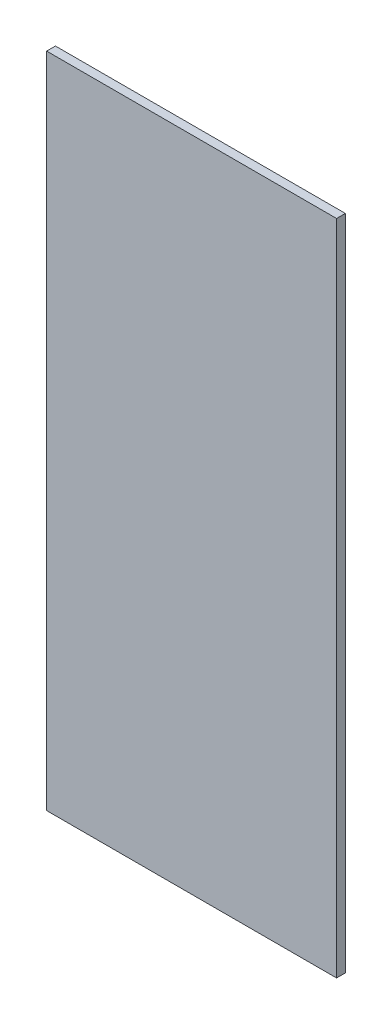
from build123d import *

# Parameters (mm, degrees)
SKETCH1_W           = 330
SKETCH1_H           = 748.610238694
BOSS_EXTRUDE1_DEPTH = 5


with BuildPart() as part:
    # Sketch1 → Boss-Extrude1 (new, symmetric)
    with BuildSketch(Plane.XY):
        with Locations((845, -740)):
            Rectangle(SKETCH1_W, SKETCH1_H)
    extrude(amount=BOSS_EXTRUDE1_DEPTH, both=True)


solid = part.part
